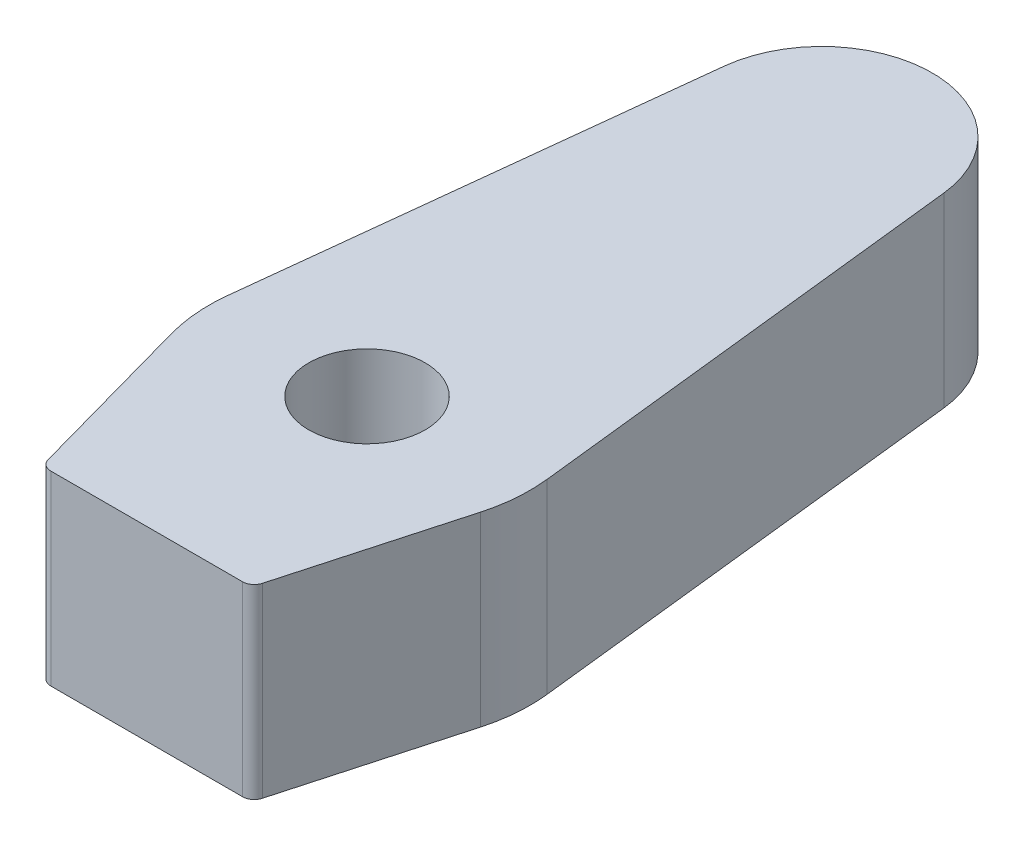
from build123d import *

# Parameters (mm, degrees)
BOSS_EXTRUDE4_DEPTH = 8
SKETCH2_R           = 2.5
CUT_EXTRUDE1_DEPTH  = 5.15


with BuildPart() as part:
    # Sketch1 → Boss-Extrude4 (new body)
    with BuildSketch(Plane(origin=(0, 0, 0), x_dir=(1, 0, 0), z_dir=(0, 1, 0))):
        with BuildLine():
            Line((-4.119957175, -14.5), (4.119957175, -14.5))
            ThreePointArc((4.119957175, -14.5), (4.42252042, -14.398064672), (4.60171613, -14.133821932))
            Line((4.60171613, -14.133821932), (6.638196956, -6.80249096))
            ThreePointArc((6.638196956, -6.80249096), (6.871082847, -5.489641243), (6.850811782, -4.156449845))
            Line((6.850811782, -4.156449845), (4.720984417, 15.024219546))
            ThreePointArc((4.720984417, 15.024219546), (0, 19.25), (-4.720984417, 15.024219546))
            Line((-4.720984417, 15.024219546), (-6.850811782, -4.156449845))
            ThreePointArc((-6.850811782, -4.156449845), (-6.871082847, -5.489641243), (-6.638196956, -6.80249096))
            Line((-6.638196956, -6.80249096), (-4.60171613, -14.133821932))
            ThreePointArc((-4.60171613, -14.133821932), (-4.42252042, -14.398064672), (-4.119957175, -14.5))
        make_face()
    extrude(amount=BOSS_EXTRUDE4_DEPTH)

    # Sketch2 → Cut-Extrude1 (cut)
    with BuildSketch(Plane(origin=(0, 8, 0), x_dir=(1, 0, 0), z_dir=(0, 1, 0))):
        with Locations(Location((-0.106428412, -4.928983913, 0), (0, 0, 270))):
            Circle(SKETCH2_R)
    extrude(amount=-CUT_EXTRUDE1_DEPTH, mode=Mode.SUBTRACT)


solid = part.part
